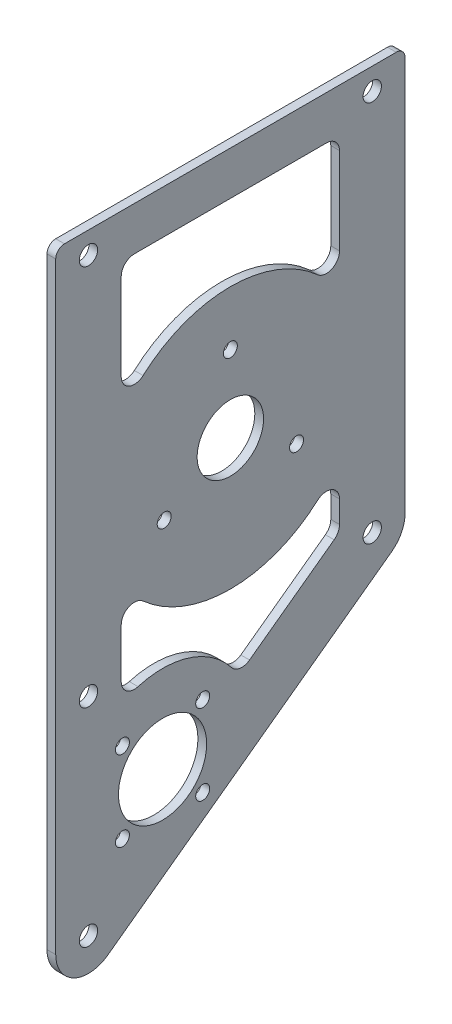
from build123d import *

# Parameters (mm, degrees)
SKETCH_1_R          = 1.6
SKETCH_1_R_2        = 10.1
SKETCH_1_R_3        = 2.1
SKETCH_1_R_4        = 7.6
EXTRUDE_1_DEPTH     = 2
SKETCH_3_W          = 50
SKETCH_3_H          = 5
CUT_EXTRUDE_1_DEPTH = 99.508882848
FILLET_1_R          = 3.005
FILLET_2_R          = 2


with BuildPart() as part:
    # ｽｹｯﾁ1 → ﾎﾞｽ - 押し出し1 (new body)
    with BuildSketch(Plane(origin=(0, 0, 0), x_dir=(0, 0, -1), z_dir=(1, 0, 0))):
        with BuildLine():
            Line((-28.07487558, -88.555433417), (36.92512442, -41.055433417))
            ThreePointArc((36.92512442, -41.055433417), (39.187242823, -38.395700727), (40, -35))
            Line((40, -35), (40, 57.5))
            Line((40, 57.5), (-40, 57.5))
            Line((-40, 57.5), (-40, -82.5))
            ThreePointArc((-40, -82.5), (-35.895700727, -89.187242823), (-28.07487558, -88.555433417))
        make_face()
        with Locations((-24.721530862, -67.147937733)):
            Circle(SKETCH_1_R, mode=Mode.SUBTRACT)
        with Locations((-15.529142706, -57.955549577)):
            Circle(SKETCH_1_R_2, mode=Mode.SUBTRACT)
        with Locations((-6.336754551, -67.147937733)):
            Circle(SKETCH_1_R, mode=Mode.SUBTRACT)
        with Locations((-32.5, -35)):
            Circle(SKETCH_1_R_3, mode=Mode.SUBTRACT)
        with Locations((-24.721530862, -48.763161422)):
            Circle(SKETCH_1_R, mode=Mode.SUBTRACT)
        with Locations((-6.336754551, -48.763161422)):
            Circle(SKETCH_1_R, mode=Mode.SUBTRACT)
        with Locations((-15.155444566, -8.75)):
            Circle(SKETCH_1_R, mode=Mode.SUBTRACT)
        with Locations((-32.5, 52.5)):
            Circle(SKETCH_1_R_3, mode=Mode.SUBTRACT)
        Circle(SKETCH_1_R_4, mode=Mode.SUBTRACT)
        with Locations((15.155444566, -8.75)):
            Circle(SKETCH_1_R, mode=Mode.SUBTRACT)
        with Locations((0, 17.5)):
            Circle(SKETCH_1_R, mode=Mode.SUBTRACT)
        with Locations((32.5, 52.5)):
            Circle(SKETCH_1_R_3, mode=Mode.SUBTRACT)
        with Locations((32.5, -35)):
            Circle(SKETCH_1_R_3, mode=Mode.SUBTRACT)
        with Locations((-32.5, -82.5)):
            Circle(SKETCH_1_R_3, mode=Mode.SUBTRACT)
    extrude(amount=EXTRUDE_1_DEPTH)

    # ｽｹｯﾁ3 → ｶｯﾄ - 押し出し1 (cut, through all)
    with BuildSketch(Plane(origin=(2, 0, 0), x_dir=(0, 0, -1), z_dir=(1, 0, 0))):
        with BuildLine():
            Line((25, -31.191591045), (25, -16.583123952))
            ThreePointArc((25, -16.583123952), (0, -30), (-25, -16.583123952))
            Line((-25, -16.583123952), (-25, -40.340134109))
            ThreePointArc((-25, -40.340134109), (-9.984170602, -38.739585267), (1.870513324, -48.093908232))
            Line((1.870513324, -48.093908232), (25, -31.191591045))
        make_face()
        with BuildLine():
            Line((25, 16.583123952), (25, 42.5))
            Line((25, 42.5), (-25, 42.5))
            Line((-25, 42.5), (-25, 16.583123952))
            ThreePointArc((-25, 16.583123952), (0, 30), (25, 16.583123952))
        make_face()
        with Locations((0, 45)):
            Rectangle(SKETCH_3_W, SKETCH_3_H)
    extrude(amount=-CUT_EXTRUDE_1_DEPTH, mode=Mode.SUBTRACT)

    # ﾌｨﾚｯﾄ1
    fillet_1_edges = [part.edges().sort_by_distance(p)[0] for p in [
        (1, -48.093908232, -1.870513324),
        (1, -40.340134109, 25),
        (1, -16.583123952, 25),
        (1, -16.583123952, -25),
        (1, -31.191591045, -25),
        (1, 16.583123952, -25),
        (1, 16.583123952, 25),
        (1, 47.5, 25),
        (1, 47.5, -25),
    ]]
    fillet(fillet_1_edges, radius=FILLET_1_R)

    # ﾌｨﾚｯﾄ2
    fillet_2_edges = [part.edges().sort_by_distance(p)[0] for p in [
        (1, 57.5, 40),
        (1, 57.5, -40),
    ]]
    fillet(fillet_2_edges, radius=FILLET_2_R)


solid = part.part
